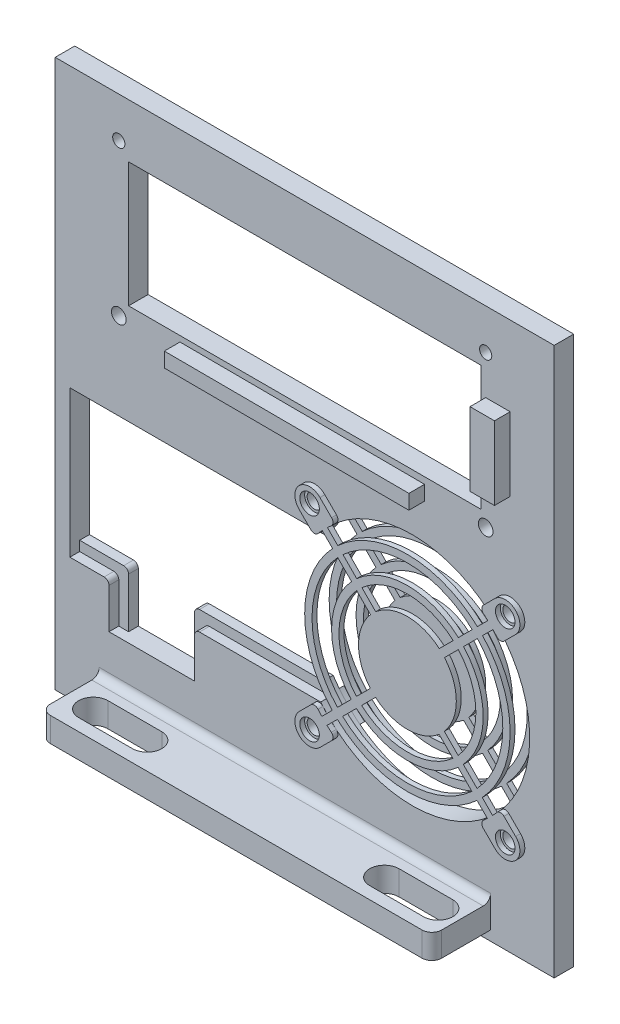
from build123d import *

# Parameters (mm, degrees)
SKETCH1_W           = 100
SKETCH1_H           = 112
BOSS_EXTRUDE1_DEPTH = 4
SKETCH2_W           = 80
SKETCH2_H           = 5
BOSS_EXTRUDE2_DEPTH = 12
CUT_EXTRUDE1_DEPTH  = 10
FILLET1_R           = 2
SKETCH5_R           = 1.25
SKETCH5_R_2         = 1.5
SKETCH5_W           = 72
SKETCH5_H           = 25.5
CUT_EXTRUDE2_DEPTH  = 10
FILLET2_R           = 1.5
CUT_EXTRUDE3_DEPTH  = 2
SKETCH8_W           = 4
SKETCH8_H           = 112
BOSS_EXTRUDE3_DEPTH = 1
SKETCH9_W           = 4
SKETCH9_H           = 112
BOSS_EXTRUDE4_DEPTH = 1
SKETCH10_W          = 5
SKETCH10_H          = 15
BOSS_EXTRUDE5_DEPTH = 3.2
SKETCH11_W          = 13.5
SKETCH11_H          = 11.2
CUT_EXTRUDE4_DEPTH  = 10
SKETCH12_W          = 2
SKETCH12_H          = 9.2
CUT_EXTRUDE5_DEPTH  = 2
FILLET3_R           = 1
SKETCH13_R          = 1.5
CUT_EXTRUDE6_DEPTH  = 152.291110116
BOSS_EXTRUDE6_DEPTH = 3.2
SKETCH16_R          = 2
BOSS_EXTRUDE7_DEPTH = 1
LPATTERN2_COUNT     = 2
LPATTERN2_PITCH     = 5
FILLET4_R           = 1


with BuildPart() as part:
    # Sketch1 → Boss-Extrude1 (new body)
    with BuildSketch(Plane.XY):
        with Locations((50, 56)):
            Rectangle(SKETCH1_W, SKETCH1_H)
    extrude(amount=BOSS_EXTRUDE1_DEPTH)

    # Sketch2 → Boss-Extrude2 (add)
    with BuildSketch(Plane.XY.offset(4)):
        with Locations((48, 4.5)):
            Rectangle(SKETCH2_W, SKETCH2_H)
    extrude(amount=BOSS_EXTRUDE2_DEPTH)

    # Sketch4 → Cut-Extrude1 (cut)
    with BuildSketch(Plane(origin=(0, 7, 0), x_dir=(1, 0, 0), z_dir=(0, 1, 0))):
        with BuildLine():
            Line((83.791997204, -13.5), (72.791997204, -13.5))
            ThreePointArc((72.791997204, -13.5), (69.791997204, -10.5), (72.791997204, -7.5))
            Line((72.791997204, -7.5), (83.791997204, -7.5))
            ThreePointArc((83.791997204, -7.5), (86.791997204, -10.5), (83.791997204, -13.5))
        make_face()
        with BuildLine():
            Line((24.291997204, -13.5), (13.291997204, -13.5))
            ThreePointArc((13.291997204, -13.5), (10.291997204, -10.5), (13.291997204, -7.5))
            Line((13.291997204, -7.5), (24.291997204, -7.5))
            ThreePointArc((24.291997204, -7.5), (27.291997204, -10.5), (24.291997204, -13.5))
        make_face()
    extrude(amount=-CUT_EXTRUDE1_DEPTH, mode=Mode.SUBTRACT)

    # Fillet1
    fillet1_edges = [part.edges().sort_by_distance(p)[0] for p in [
        (8, 4.5, 16),
        (88, 4.5, 16),
    ]]
    fillet(fillet1_edges, radius=FILLET1_R)

    # Sketch5 → Cut-Extrude2 (cut)
    with BuildSketch(Plane.XY.offset(4)):
        with Locations((12, 103.75)):
            Circle(SKETCH5_R)
        with Locations((87, 103.75)):
            Circle(SKETCH5_R)
        with Locations((12, 72.75)):
            Circle(SKETCH5_R)
        with Locations((87, 72.75)):
            Circle(SKETCH5_R)
        with Locations((92, 60)):
            Circle(SKETCH5_R_2)
        with Locations((52, 60)):
            Circle(SKETCH5_R_2)
        with Locations((52, 20)):
            Circle(SKETCH5_R_2)
        with Locations((92, 20)):
            Circle(SKETCH5_R_2)
        with BuildLine():
            Line((2, 53), (47, 53))
            Line((47, 53), (51.825758998, 53))
            ThreePointArc((51.825758998, 53), (96, 40), (51.825758998, 27))
            Line((51.825758998, 27), (47, 27))
            Line((47, 27), (2, 27))
            Line((2, 27), (2, 53))
        make_face()
        with Locations((50, 88.25)):
            Rectangle(SKETCH5_W, SKETCH5_H)
    extrude(amount=-CUT_EXTRUDE2_DEPTH, mode=Mode.SUBTRACT)

    # Fillet2
    fillet2_edges = [part.edges().sort_by_distance(p)[0] for p in [
        (48, 7, 4),
    ]]
    fillet(fillet2_edges, radius=FILLET2_R)

    # Sketch6 → Cut-Extrude3 (cut)
    with BuildSketch(Plane.XY.offset(4)):
        Polygon((51.825758998, 53), (2, 53), (2, 55), (52, 55), (58.675044279, 55), (58.675044279, 53), align=None)
        Polygon((51.825758998, 27), (2, 27), (2, 25), (51.825758998, 25), (57.319724107, 25), (57.319724107, 27), align=None)
    extrude(amount=-CUT_EXTRUDE3_DEPTH, mode=Mode.SUBTRACT)

    # Sketch8 → Boss-Extrude3 (add)
    with BuildSketch(Plane.ZY):
        with Locations((2, 56)):
            Rectangle(SKETCH8_W, SKETCH8_H)
    extrude(amount=BOSS_EXTRUDE3_DEPTH)

    # Sketch9 → Boss-Extrude4 (add)
    with BuildSketch(Plane(origin=(100, 0, 0), x_dir=(0, 0, -1), z_dir=(1, 0, 0))):
        with Locations((-2, 56)):
            Rectangle(SKETCH9_W, SKETCH9_H)
    extrude(amount=BOSS_EXTRUDE4_DEPTH)

    # Sketch10 → Boss-Extrude5 (add)
    with BuildSketch(Plane.XY.offset(4)):
        with Locations((89.5, 88.25)):
            Rectangle(SKETCH10_W, SKETCH10_H)
    extrude(amount=BOSS_EXTRUDE5_DEPTH)

    # Sketch11 → Cut-Extrude4 (cut)
    with BuildSketch(Plane.XY.offset(4)):
        with Locations((18.75, 21.4)):
            Rectangle(SKETCH11_W, SKETCH11_H)
    extrude(amount=-CUT_EXTRUDE4_DEPTH, mode=Mode.SUBTRACT)

    # Sketch12 → Cut-Extrude5 (cut)
    with BuildSketch(Plane.XY.offset(4)):
        with Locations((11, 20.4)):
            Rectangle(SKETCH12_W, SKETCH12_H)
        with Locations((26.5, 20.4)):
            Rectangle(SKETCH12_W, SKETCH12_H)
    extrude(amount=-CUT_EXTRUDE5_DEPTH, mode=Mode.SUBTRACT)

    # Fillet3
    fillet3_edges = [part.edges().sort_by_distance(p)[0] for p in [
        (25.5, 27, 1),
        (12, 27, 1),
        (10, 25, 3),
        (27.5, 25, 3),
    ]]
    fillet(fillet3_edges, radius=FILLET3_R)

    # Sketch13 → Cut-Extrude6 (cut, through all)
    with BuildSketch(Plane.XY.offset(4)):
        with Locations((12, 72.75)):
            Circle(SKETCH13_R)
        with Locations((87, 72.75)):
            Circle(SKETCH13_R)
    extrude(amount=-CUT_EXTRUDE6_DEPTH, mode=Mode.SUBTRACT)

    # Sketch15 → Boss-Extrude6 (add)
    with BuildSketch(Plane.XY.offset(4)):
        Polygon((74.505466292, 74.155935811), (24.505820137, 74.344042958), (24.494533708, 71.344064189), (74.494179863, 71.155957042), align=None)
    extrude(amount=BOSS_EXTRUDE6_DEPTH)


with BuildPart() as body_2:
    # Sketch16 → Boss-Extrude7 (new body)
    with BuildSketch(Plane(origin=(0, 0, 0), x_dir=(-1, 0, 0), z_dir=(0, 0, -1))):
        with BuildLine():
            ThreePointArc((-89.878679656, 62.121320344), (-94.121320344, 62.121320344), (-94.121320344, 57.878679656))
            Line((-94.121320344, 57.878679656), (-90.958778584, 54.716137897))
            ThreePointArc((-90.958778584, 54.716137897), (-90.24587154, 55.591285122), (-89.492604403, 56.431944231))
            Line((-89.492604403, 56.431944231), (-87.370099289, 54.309439117))
            ThreePointArc((-87.370099289, 54.309439117), (-92.99993614, 39.948211038), (-87.299334356, 25.614925503))
            Line((-87.299334356, 25.614925503), (-89.41134489, 23.481977445))
            ThreePointArc((-89.41134489, 23.481977445), (-90.207365747, 24.363765398), (-90.958778584, 25.283862103))
            Line((-90.958778584, 25.283862103), (-94.121320344, 22.121320344))
            ThreePointArc((-94.121320344, 22.121320344), (-94.121320344, 17.878679656), (-89.878679656, 17.878679656))
            Line((-89.878679656, 17.878679656), (-86.716137897, 21.041221416))
            ThreePointArc((-86.716137897, 21.041221416), (-87.546240817, 21.715733636), (-88.34546616, 22.426561634))
            Line((-88.34546616, 22.426561634), (-86.233455626, 24.559509692))
            ThreePointArc((-86.233455626, 24.559509692), (-71.948211038, 19.00006386), (-57.690560883, 24.629900711))
            Line((-57.690560883, 24.629900711), (-55.568055769, 22.507395597))
            ThreePointArc((-55.568055769, 22.507395597), (-56.408714878, 21.75412846), (-57.283862103, 21.041221416))
            Line((-57.283862103, 21.041221416), (-54.121320344, 17.878679656))
            ThreePointArc((-54.121320344, 17.878679656), (-49.878679656, 17.878679656), (-49.878679656, 22.121320344))
            Line((-49.878679656, 22.121320344), (-53.041221416, 25.283862103))
            ThreePointArc((-53.041221416, 25.283862103), (-53.75412846, 24.408714878), (-54.507395597, 23.568055769))
            Line((-54.507395597, 23.568055769), (-56.629900711, 25.690560883))
            ThreePointArc((-56.629900711, 25.690560883), (-51.00006386, 40.051788962), (-56.700665644, 54.385074497))
            Line((-56.700665644, 54.385074497), (-54.58865511, 56.518022555))
            ThreePointArc((-54.58865511, 56.518022555), (-53.792634253, 55.636234602), (-53.041221416, 54.716137897))
            Line((-53.041221416, 54.716137897), (-49.878679656, 57.878679656))
            ThreePointArc((-49.878679656, 57.878679656), (-49.878679656, 62.121320344), (-54.121320344, 62.121320344))
            Line((-54.121320344, 62.121320344), (-57.283862103, 58.958778584))
            ThreePointArc((-57.283862103, 58.958778584), (-56.453759183, 58.284266364), (-55.65453384, 57.573438366))
            Line((-55.65453384, 57.573438366), (-57.766544374, 55.440490308))
            ThreePointArc((-57.766544374, 55.440490308), (-72.051788962, 60.99993614), (-86.309439117, 55.370099289))
            Line((-86.309439117, 55.370099289), (-88.431944231, 57.492604403))
            ThreePointArc((-88.431944231, 57.492604403), (-87.591285122, 58.24587154), (-86.716137897, 58.958778584))
            Line((-86.716137897, 58.958778584), (-89.878679656, 62.121320344))
        make_face()
        with Locations((-92, 20)):
            Circle(SKETCH16_R, mode=Mode.SUBTRACT)
        with BuildLine():
            Line((-86.308709889, 53.248049717), (-83.477647109, 50.416986937))
            ThreePointArc((-83.477647109, 50.416986937), (-87.499952866, 39.961774814), (-83.426128136, 29.526528951))
            Line((-83.426128136, 29.526528951), (-86.243192922, 26.681537049))
            ThreePointArc((-86.243192922, 26.681537049), (-91.499940702, 39.951910249), (-86.308709889, 53.248049717))
        make_face(mode=Mode.SUBTRACT)
        with BuildLine():
            Line((-82.415609546, 49.354949374), (-79.581482474, 46.520822302))
            ThreePointArc((-79.581482474, 46.520822302), (-81.999969591, 39.975338589), (-79.549227818, 33.441863119))
            Line((-79.549227818, 33.441863119), (-82.369341744, 30.593791848))
            ThreePointArc((-82.369341744, 30.593791848), (-85.999957427, 39.965474025), (-82.415609546, 49.354949374))
        make_face(mode=Mode.SUBTRACT)
        with BuildLine():
            Line((-61.583013063, 28.522352891), (-58.751950283, 25.691290111))
            ThreePointArc((-58.751950283, 25.691290111), (-71.951910249, 20.500059298), (-85.177314193, 25.626121238))
            Line((-85.177314193, 25.626121238), (-82.360249407, 28.47111314))
            ThreePointArc((-82.360249407, 28.47111314), (-71.961774814, 24.500047134), (-61.583013063, 28.522352891))
        make_face(mode=Mode.SUBTRACT)
        with Locations((-52, 20)):
            Circle(SKETCH16_R, mode=Mode.SUBTRACT)
        with BuildLine():
            Line((-81.303463015, 29.538376038), (-78.483349088, 32.386447308))
            ThreePointArc((-78.483349088, 32.386447308), (-71.975338589, 30.000030409), (-65.479177698, 32.418517526))
            Line((-65.479177698, 32.418517526), (-62.645050626, 29.584390454))
            ThreePointArc((-62.645050626, 29.584390454), (-71.965474025, 26.000042573), (-81.303463015, 29.538376038))
        make_face(mode=Mode.SUBTRACT)
        with BuildLine():
            ThreePointArc((-65.516650912, 47.613552692), (-72.024661411, 49.999969591), (-78.520822302, 47.581482474))
            Line((-78.520822302, 47.581482474), (-81.354949374, 50.415609546))
            ThreePointArc((-81.354949374, 50.415609546), (-72.034525975, 53.999957427), (-62.696536985, 50.461623962))
            Line((-62.696536985, 50.461623962), (-65.516650912, 47.613552692))
        make_face(mode=Mode.SUBTRACT)
        with Locations((-92, 60)):
            Circle(SKETCH16_R, mode=Mode.SUBTRACT)
        with BuildLine():
            Line((-58.822685807, 54.373878762), (-61.639750593, 51.52888686))
            ThreePointArc((-61.639750593, 51.52888686), (-72.038225186, 55.499952866), (-82.416986937, 51.477647109))
            Line((-82.416986937, 51.477647109), (-85.248049717, 54.308709889))
            ThreePointArc((-85.248049717, 54.308709889), (-72.048089751, 59.499940702), (-58.822685807, 54.373878762))
        make_face(mode=Mode.SUBTRACT)
        with BuildLine():
            Line((-61.584390454, 30.645050626), (-64.418517526, 33.479177698))
            ThreePointArc((-64.418517526, 33.479177698), (-62.000030409, 40.024661411), (-64.450772182, 46.558136881))
            Line((-64.450772182, 46.558136881), (-61.630658256, 49.406208152))
            ThreePointArc((-61.630658256, 49.406208152), (-58.000042573, 40.034525975), (-61.584390454, 30.645050626))
        make_face(mode=Mode.SUBTRACT)
        with BuildLine():
            ThreePointArc((-60.522352891, 29.583013063), (-56.500047134, 40.038225186), (-60.573871864, 50.473471049))
            Line((-60.573871864, 50.473471049), (-57.756807078, 53.318462951))
            ThreePointArc((-57.756807078, 53.318462951), (-52.500059298, 40.048089751), (-57.691290111, 26.751950283))
            Line((-57.691290111, 26.751950283), (-60.522352891, 29.583013063))
        make_face(mode=Mode.SUBTRACT)
        with Locations((-52, 60)):
            Circle(SKETCH16_R, mode=Mode.SUBTRACT)
    boss_extrude7 = extrude(amount=BOSS_EXTRUDE7_DEPTH)


with BuildPart() as lpattern2_1:
    # LPattern2: Boss-Extrude7 ×2
    with Locations(*[(0, 0, i * LPATTERN2_PITCH) for i in range(1, LPATTERN2_COUNT)]):
        add(boss_extrude7)

    # Fillet4
    fillet4_edges = [lpattern2_1.edges().sort_by_distance(p)[0] for p in [
        (57.283862103, 58.958778584, 4.5),
        (53.041221416, 54.716137897, 4.5),
        (53.041221416, 25.283862103, 4.5),
        (57.283862103, 21.041221416, 4.5),
        (86.716137897, 21.041221416, 4.5),
        (90.958778584, 25.283862103, 4.5),
        (90.958778584, 54.716137897, 4.5),
        (86.716137897, 58.958778584, 4.5),
    ]]
    fillet(fillet4_edges, radius=FILLET4_R)


solid = Compound([part.part, body_2.part, lpattern2_1.part])
